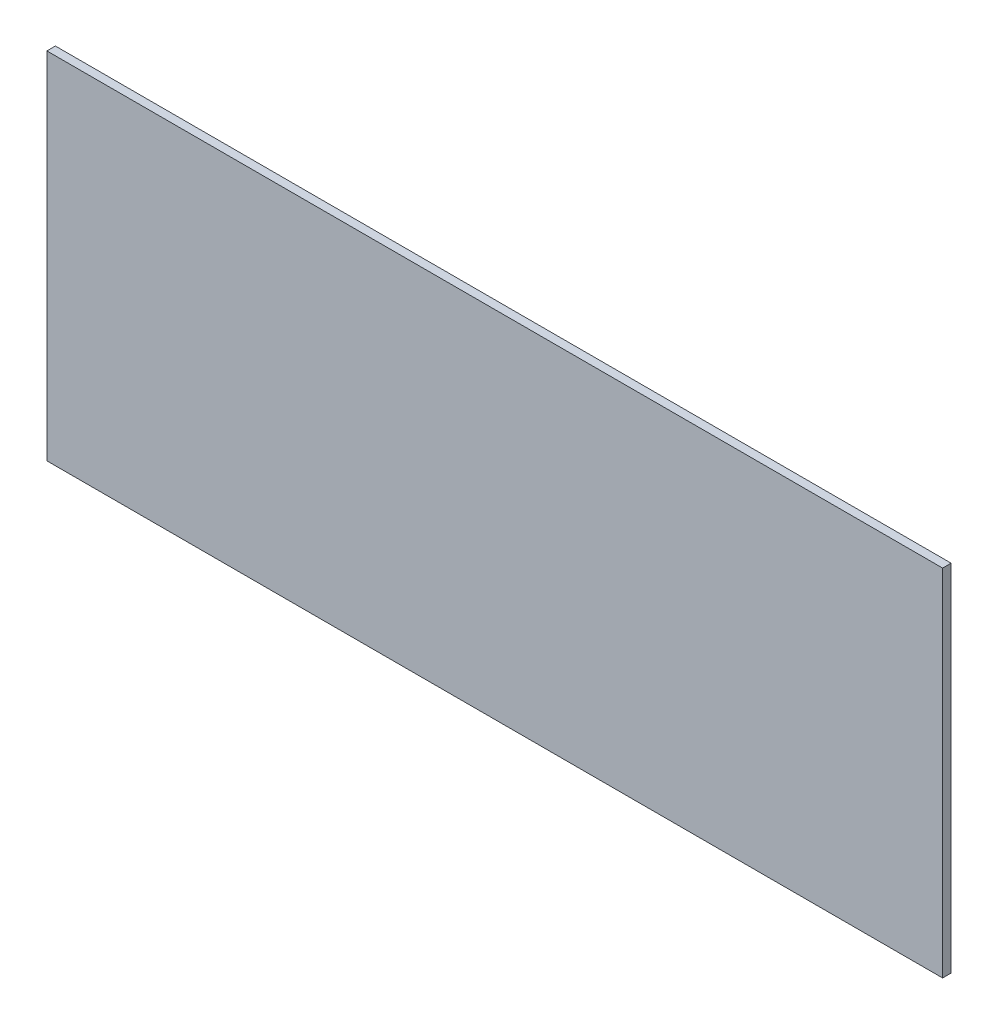
from build123d import *

# Parameters (mm, degrees)
SKETCH1_W           = 588.8239938
SKETCH1_H           = 233.3760128
BOSS_EXTRUDE1_DEPTH = 5.588


with BuildPart() as part:
    # Sketch1 → Boss-Extrude1 (new body)
    with BuildSketch(Plane.XY):
        Rectangle(SKETCH1_W, SKETCH1_H)
    extrude(amount=BOSS_EXTRUDE1_DEPTH)


solid = part.part
